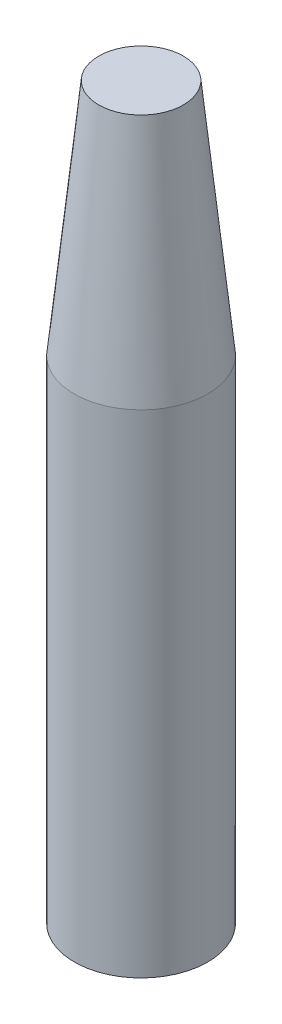
from build123d import *

# Parameters (mm, degrees)
SKETCH1_R           = 12.625
BOSS_EXTRUDE1_DEPTH = 93
SKETCH2_R           = 8
BOSS_EXTRUDE2_DEPTH = 45


with BuildPart() as part:
    # Sketch1 → Boss-Extrude1 (new body)
    with BuildSketch(Plane(origin=(0, 0, 0), x_dir=(1, 0, 0), z_dir=(0, 1, 0))):
        with Locations(Location((0, 0, 0), (0, 0, 90))):
            Circle(SKETCH1_R)
    extrude(amount=BOSS_EXTRUDE1_DEPTH)

    # Sketch2 → Boss-Extrude2 (add)
    with BuildSketch(Plane(origin=(0, 93, 0), x_dir=(1, 0, 0), z_dir=(0, 1, 0))):
        with Locations(Location((0, 0, 0), (0, 0, 90))):
            Circle(SKETCH2_R)
    extrude(amount=BOSS_EXTRUDE2_DEPTH)

    # Sketch3 → Revolve1 (revolve)
    with BuildSketch(Plane.XY, mode=Mode.PRIVATE) as revolve1_sk:
        Polygon((12.625, 93), (8, 138), (8, 93), align=None)
    revolve(revolve1_sk.sketch.rotate(Axis((0, 138, 0), (0, -1, 0)), 270), axis=Axis((0, 138, 0), (0, -1, 0)))


solid = part.part
